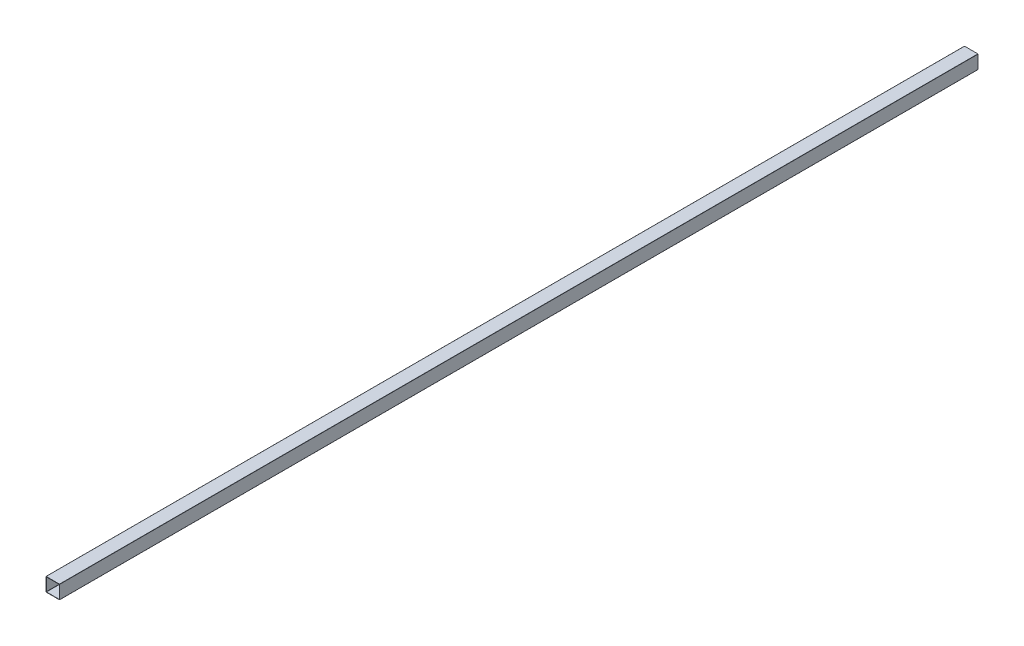
from build123d import *

# Parameters (mm, degrees)
CROQUIS1_W              = 88.9
CROQUIS1_H              = 88.9
CROQUIS1_W_2            = 85.12
CROQUIS1_H_2            = 85.12
SALIENTE_EXTRUIR1_DEPTH = 6000
REDONDEO1_R             = 1


with BuildPart() as part:
    # Croquis1 → Saliente-Extruir1 (new body)
    with BuildSketch(Plane.XY):
        Rectangle(CROQUIS1_W, CROQUIS1_H)
        Rectangle(CROQUIS1_W_2, CROQUIS1_H_2, mode=Mode.SUBTRACT)
    extrude(amount=-SALIENTE_EXTRUIR1_DEPTH)

    # Redondeo1
    redondeo1_edges = [part.edges().sort_by_distance(p)[0] for p in [
        (42.56, -42.56, -3000),
        (-42.56, -42.56, -3000),
        (-42.56, 42.56, -3000),
        (42.56, 42.56, -3000),
        (44.45, -44.45, -3000),
        (-44.45, -44.45, -3000),
        (-44.45, 44.45, -3000),
        (44.45, 44.45, -3000),
    ]]
    fillet(redondeo1_edges, radius=REDONDEO1_R)


solid = part.part
